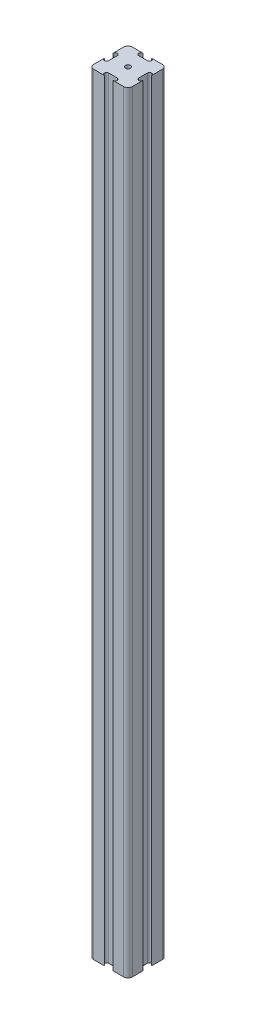
from build123d import *

# Parameters (mm, degrees)
BOSS_EXTRU_2_DEPTH      = 900
ESQUISSE5_R             = 3
ENL_V_MAT_EXTRU_1_DEPTH = 901.562324329


with BuildPart() as part:
    # Esquisse4 → Boss.-Extru.2 (new body)
    with BuildSketch(Plane(origin=(0, 0, 0), x_dir=(1, 0, 0), z_dir=(0, 1, 0))):
        with BuildLine():
            Line((-17.5, 22.5), (-5, 22.5))
            ThreePointArc((-5, 22.5), (-7.5, 20), (-5, 17.5))
            Line((-5, 17.5), (5, 17.5))
            ThreePointArc((5, 17.5), (7.5, 20), (5, 22.5))
            Line((5, 22.5), (17.5, 22.5))
            ThreePointArc((17.5, 22.5), (21.035534799, 21.035533013), (22.5, 17.499997475))
            Line((22.5, 17.499997475), (22.5, 4.999997475))
            ThreePointArc((22.5, 4.999997475), (20, 7.499997475), (17.5, 4.999997475))
            Line((17.5, 4.999997475), (17.5, -5.000002525))
            ThreePointArc((17.5, -5.000002525), (20, -7.500002525), (22.5, -5.000002525))
            Line((22.5, -5.000002525), (22.5, -17.500002525))
            ThreePointArc((22.5, -17.500002525), (21.035533013, -21.035534799), (17.5, -22.5))
            Line((17.5, -22.5), (5, -22.5))
            ThreePointArc((5, -22.5), (7.5, -20), (5, -17.5))
            Line((5, -17.5), (-5, -17.5))
            ThreePointArc((-5, -17.5), (-7.5, -20), (-5, -22.5))
            Line((-5, -22.5), (-17.5, -22.5))
            ThreePointArc((-17.5, -22.5), (-21.035533906, -21.035533906), (-22.5, -17.5))
            Line((-22.5, -17.5), (-22.5, -5))
            ThreePointArc((-22.5, -5), (-20, -7.5), (-17.5, -5))
            Line((-17.5, -5), (-17.5, 5))
            ThreePointArc((-17.5, 5), (-20, 7.5), (-22.5, 5))
            Line((-22.5, 5), (-22.5, 17.5))
            ThreePointArc((-22.5, 17.5), (-21.035533906, 21.035533906), (-17.5, 22.5))
        make_face()
    extrude(amount=BOSS_EXTRU_2_DEPTH)

    # Esquisse5 → Enlèv. mat.-Extru.1 (cut, through all)
    with BuildSketch(Plane.XZ):
        with Locations(Location((0, 0, 0), (0, 0, 270))):
            Circle(ESQUISSE5_R)
    extrude(amount=-ENL_V_MAT_EXTRU_1_DEPTH, mode=Mode.SUBTRACT)


solid = part.part
